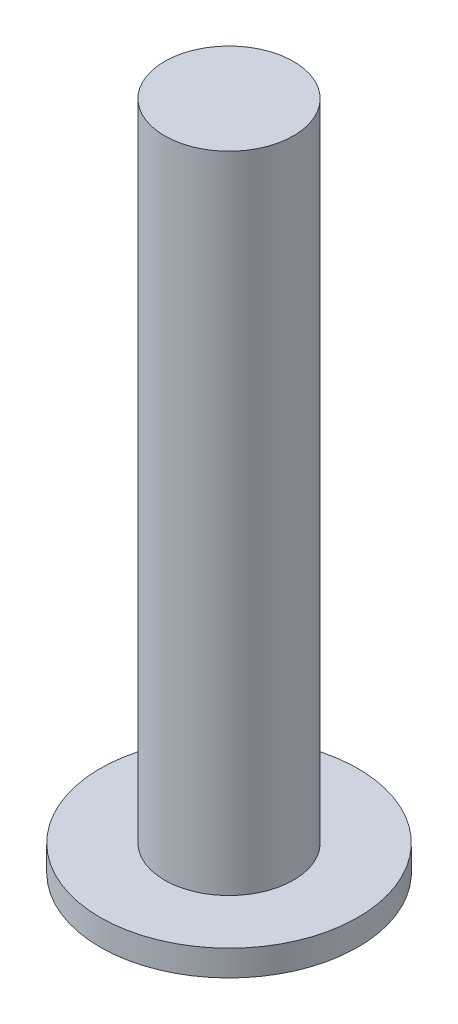
from build123d import *

# Parameters (mm, degrees)
SKETCH1_R           = 100
BOSS_EXTRUDE1_DEPTH = 20
SKETCH2_R           = 50
BOSS_EXTRUDE2_DEPTH = 500


with BuildPart() as part:
    # Sketch1 → Boss-Extrude1 (new body)
    with BuildSketch(Plane(origin=(0, 0, 0), x_dir=(1, 0, 0), z_dir=(0, 1, 0))):
        with Locations(Location((0, 0, 0), (0, 0, 270))):
            Circle(SKETCH1_R)
    extrude(amount=BOSS_EXTRUDE1_DEPTH)

    # Sketch2 → Boss-Extrude2 (add)
    with BuildSketch(Plane(origin=(0, 20, 0), x_dir=(1, 0, 0), z_dir=(0, 1, 0))):
        with Locations(Location((0, 0, 0), (0, 0, 270))):
            Circle(SKETCH2_R)
    extrude(amount=BOSS_EXTRUDE2_DEPTH)


solid = part.part
